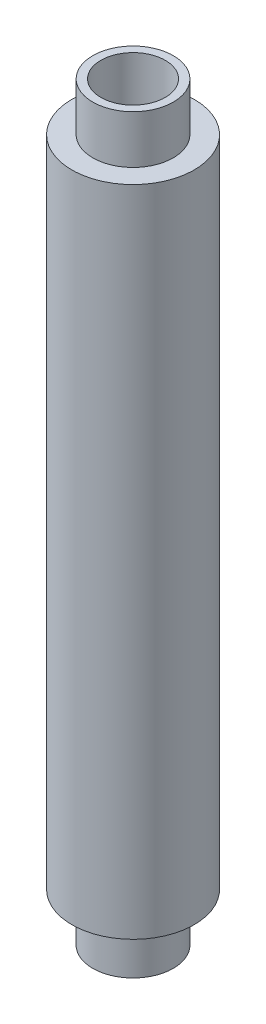
from build123d import *

# Parameters (mm, degrees)
SKETCH1_R           = 19
BOSS_EXTRUDE1_DEPTH = 203
SKETCH2_R           = 12.5
SKETCH2_R_2         = 10
BOSS_EXTRUDE2_DEPTH = 15
BOSS_EXTRUDE3_START = 15
SKETCH3_R           = 12.5
SKETCH3_R_2         = 10
BOSS_EXTRUDE3_DEPTH = 15


with BuildPart() as part:
    # Sketch1 → Boss-Extrude1 (new body)
    with BuildSketch(Plane(origin=(0, 0, 0), x_dir=(1, 0, 0), z_dir=(0, 1, 0))):
        with Locations(Location((0, 0, 0), (0, 0, 90))):
            Circle(SKETCH1_R)
    extrude(amount=BOSS_EXTRUDE1_DEPTH)

    # Sketch2 → Boss-Extrude2 (add)
    with BuildSketch(Plane.XZ):
        with Locations(Location((0, 0, 0), (0, 0, 90))):
            Circle(SKETCH2_R)
        with Locations(Location((0, 0, 0), (0, 0, 270))):
            Circle(SKETCH2_R_2, mode=Mode.SUBTRACT)
    extrude(amount=BOSS_EXTRUDE2_DEPTH)

    # Sketch3 → Boss-Extrude3 (add)
    with BuildSketch(Plane(origin=(0, 203, 0), x_dir=(1, 0, 0), z_dir=(0, 1, 0)).offset(BOSS_EXTRUDE3_START)):
        with Locations(Location((0, 0, 0), (0, 0, 270))):
            Circle(SKETCH3_R)
        with Locations(Location((0, 0, 0), (0, 0, 90))):
            Circle(SKETCH3_R_2, mode=Mode.SUBTRACT)
    extrude(amount=-BOSS_EXTRUDE3_DEPTH)


solid = part.part
